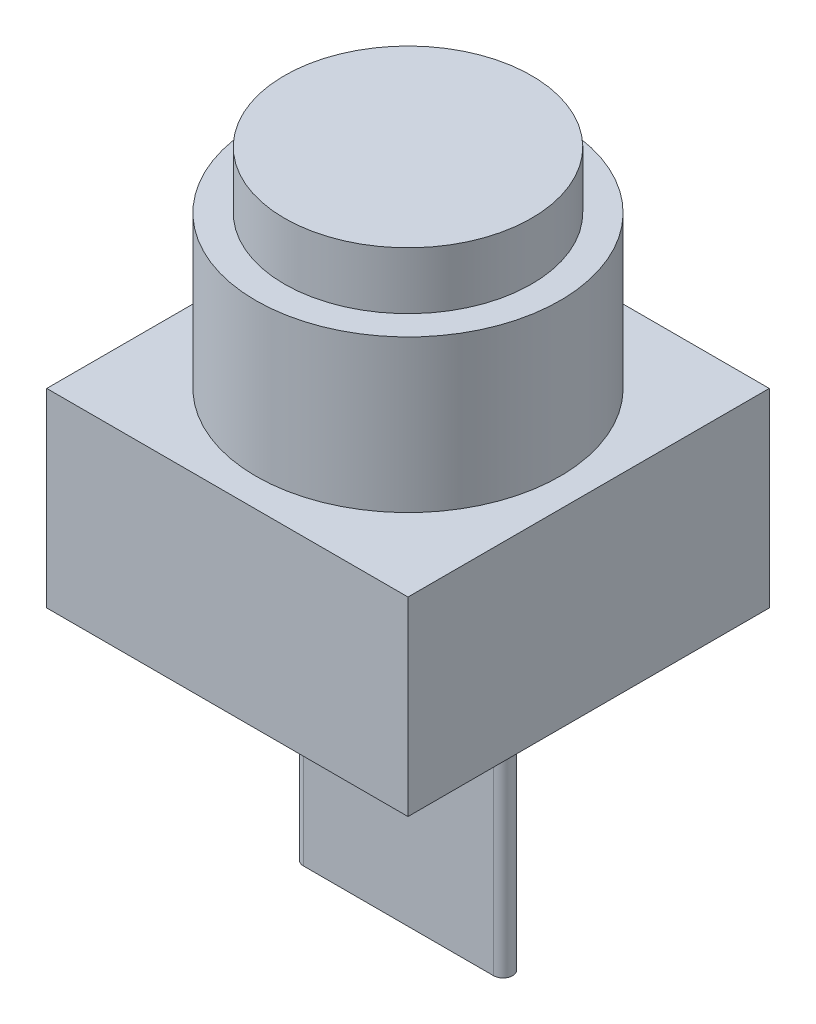
from build123d import *

# Parameters (mm, degrees)
SKETCH2_W           = 9.5
SKETCH2_H           = 9.5
BOSS_EXTRUDE1_DEPTH = 5
SKETCH3_R           = 4
BOSS_EXTRUDE2_DEPTH = 4
SKETCH4_R           = 3.25
BOSS_EXTRUDE3_DEPTH = 1.5
BOSS_EXTRUDE4_DEPTH = 7


with BuildPart() as part:
    # Sketch2 → Boss-Extrude1 (new body)
    with BuildSketch(Plane(origin=(0, 0, 0), x_dir=(1, 0, 0), z_dir=(0, 1, 0))):
        Rectangle(SKETCH2_W, SKETCH2_H)
    extrude(amount=BOSS_EXTRUDE1_DEPTH)

    # Sketch3 → Boss-Extrude2 (add)
    with BuildSketch(Plane(origin=(0, 5, 0), x_dir=(1, 0, 0), z_dir=(0, 1, 0))):
        with Locations(Location((0, 0, 0), (0, 0, 270))):
            Circle(SKETCH3_R)
    extrude(amount=BOSS_EXTRUDE2_DEPTH)

    # Sketch4 → Boss-Extrude3 (add)
    with BuildSketch(Plane(origin=(0, 9, 0), x_dir=(1, 0, 0), z_dir=(0, 1, 0))):
        with Locations(Location((0, 0, 0), (0, 0, 270))):
            Circle(SKETCH4_R)
    extrude(amount=BOSS_EXTRUDE3_DEPTH)

    # Sketch5 → Boss-Extrude4 (add)
    with BuildSketch(Plane.XZ):
        with BuildLine():
            Line((-2.5, -0.25), (2.5, -0.25))
            ThreePointArc((2.5, -0.25), (2.75, 0), (2.5, 0.25))
            Line((2.5, 0.25), (-2.5, 0.25))
            ThreePointArc((-2.5, 0.25), (-2.75, 0), (-2.5, -0.25))
        make_face()
    extrude(amount=BOSS_EXTRUDE4_DEPTH)


solid = part.part
